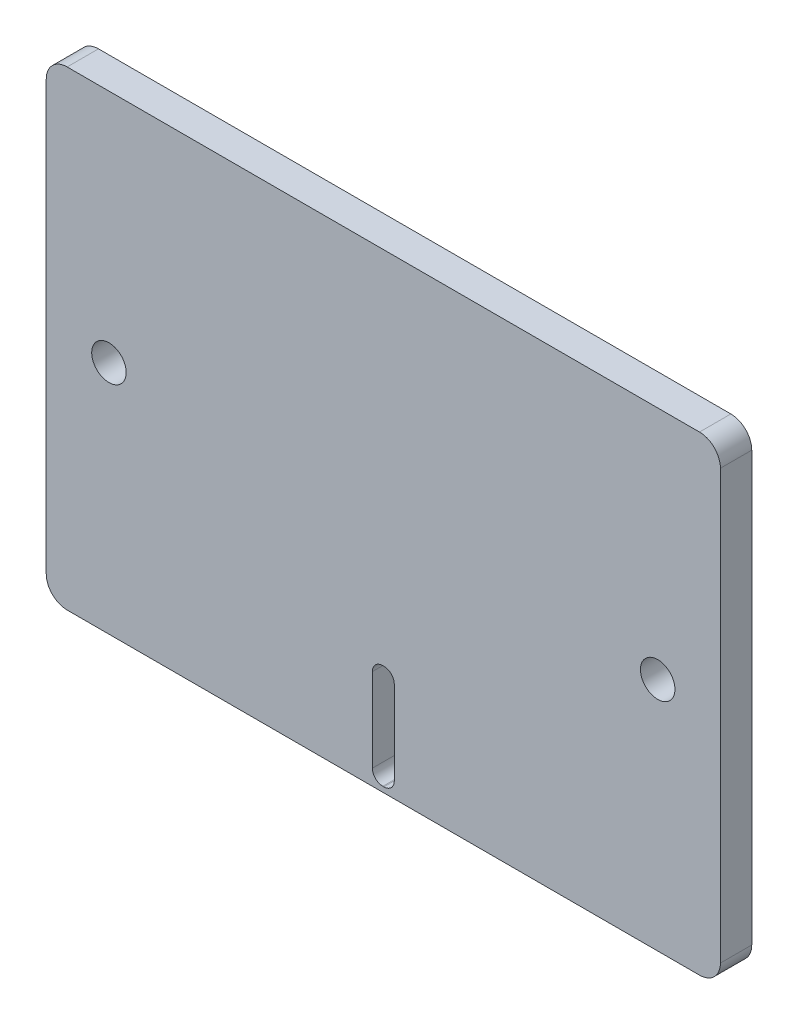
from build123d import *

# Parameters (mm, degrees)
SKETCH_1_W          = 64.5
SKETCH_1_H          = 45
EXTRUDE_1_DEPTH     = 3
SKETCH_6_W          = 12
SKETCH_6_H          = 10
EXTRUDE_4_DEPTH     = 3
FILLET_1_R          = 2
SKETCH_7_R          = 1.65
CUT_EXTRUDE_3_DEPTH = 6
SKETCH_9_W          = 6
SKETCH_9_H          = 14
CUT_EXTRUDE_4_DEPTH = 10
SKETCH_8_R          = 1.65
CUT_EXTRUDE_5_DEPTH = 10
SKETCH_10_W         = 2.1
SKETCH_10_H         = 10
CUT_EXTRUDE_6_DEPTH = 10
FILLET_2_R          = 1


with BuildPart() as part:
    # 草图1 → 凸台-拉伸1 (new body)
    with BuildSketch(Plane.XY):
        Rectangle(SKETCH_1_W, SKETCH_1_H)
    extrude(amount=EXTRUDE_1_DEPTH)

    # 草图6 → 凸台-拉伸4 (add)
    with BuildSketch(Plane.XY.offset(3)):
        with Locations((32.25, 0)):
            Rectangle(SKETCH_6_W, SKETCH_6_H)
        with Locations((-32.25, 0)):
            Rectangle(SKETCH_6_W, SKETCH_6_H)
    extrude(amount=-EXTRUDE_4_DEPTH)

    # 圆角1
    fillet_1_edges = [part.edges().sort_by_distance(p)[0] for p in [
        (38.25, -5, 1.5),
        (32.25, 5, 1.5),
        (32.25, -5, 1.5),
        (38.25, 5, 1.5),
        (-38.25, 5, 1.5),
        (-32.25, 5, 1.5),
        (-38.25, -5, 1.5),
        (-32.25, -5, 1.5),
        (32.25, -22.5, 1.5),
        (-32.25, -22.5, 1.5),
        (-32.25, 22.5, 1.5),
        (32.25, 22.5, 1.5),
    ]]
    fillet(fillet_1_edges, radius=FILLET_1_R)

    # 草图7 → 切除-拉伸3 (cut)
    with BuildSketch(Plane.XY.offset(3)):
        with Locations((-35.25, 0)):
            Circle(SKETCH_7_R)
        with Locations(Location((35.25, 0, 0), (0, 0, 180))):
            Circle(SKETCH_7_R)
    extrude(amount=-CUT_EXTRUDE_3_DEPTH, mode=Mode.SUBTRACT)

    # 草图9 → 切除-拉伸4 (cut)
    with BuildSketch(Plane.XY.offset(3)):
        with Locations((-35.25, 0)):
            Rectangle(SKETCH_9_W, SKETCH_9_H)
        with Locations((35.25, 0)):
            Rectangle(SKETCH_9_W, SKETCH_9_H)
    extrude(amount=-CUT_EXTRUDE_4_DEPTH, mode=Mode.SUBTRACT)

    # 草图8 → 切除-拉伸5 (cut)
    with BuildSketch(Plane.XY.offset(3)):
        with Locations((-26.25, 0)):
            Circle(SKETCH_8_R)
        with Locations(Location((26.25, 0, 0), (0, 0, 180))):
            Circle(SKETCH_8_R)
    extrude(amount=-CUT_EXTRUDE_5_DEPTH, mode=Mode.SUBTRACT)

    # 草图10 → 切除-拉伸6 (cut)
    with BuildSketch(Plane.XY.offset(3)):
        with Locations((0, -17)):
            Rectangle(SKETCH_10_W, SKETCH_10_H)
    extrude(amount=-CUT_EXTRUDE_6_DEPTH, mode=Mode.SUBTRACT)

    # 圆角2
    fillet_2_edges = [part.edges().sort_by_distance(p)[0] for p in [
        (1.05, -12, 1.5),
        (1.05, -22, 1.5),
        (-1.05, -22, 1.5),
        (-1.05, -12, 1.5),
    ]]
    fillet(fillet_2_edges, radius=FILLET_2_R)


solid = part.part
